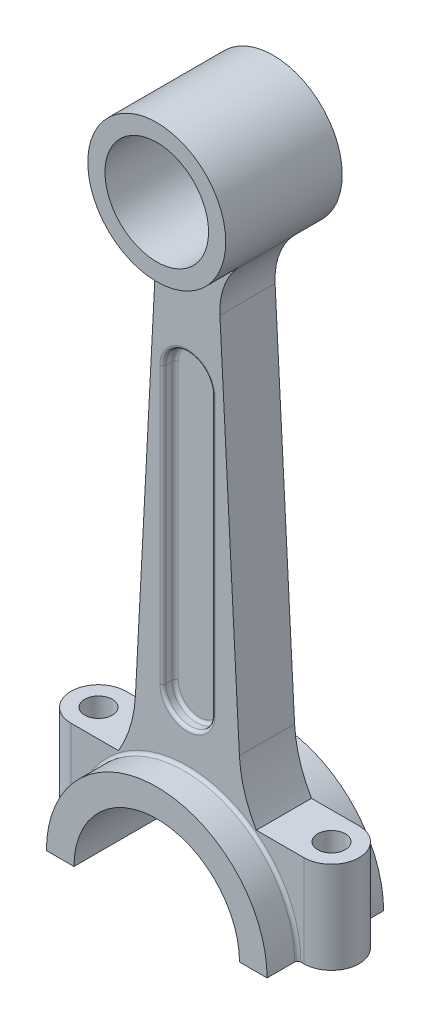
from build123d import *

# Parameters (mm, degrees)
BOSS_EXTRUDE1_DEPTH   = 19
SKETCH1_R             = 22.5
SKETCH1_R_2           = 16.9
BOSS_EXTRUDE1_2_DEPTH = 19
BOSS_EXTRUDE2_DEPTH   = 9
CUT_EXTRUDE1_DEPTH    = 4
FILLET2_R             = 1
FILLET3_R             = 22.5
FILLET4_R             = 40
BOSS_EXTRUDE3_REACH   = 199.931
SKETCH3_R             = 4.5
CUT_EXTRUDE2_DEPTH    = 209.505251829
FILLET5_R             = 1


with BuildPart() as part:
    # Sketch1 → Boss-Extrude1 (new, symmetric)
    with BuildSketch(Plane.XY):
        with BuildLine():
            ThreePointArc((-27, -201.2), (0, -174.2), (27, -201.2))
            Line((27, -201.2), (36, -201.2))
            ThreePointArc((36, -201.2), (0, -165.2), (-36, -201.2))
            Line((-36, -201.2), (-27, -201.2))
        make_face()
    extrude(amount=BOSS_EXTRUDE1_DEPTH, both=True)



with BuildPart() as body_2:
    # Sketch1 → Boss-Extrude1 2 (new, symmetric)
    with BuildSketch(Plane.XY):
        Circle(SKETCH1_R)
        Circle(SKETCH1_R_2, mode=Mode.SUBTRACT)
    extrude(amount=BOSS_EXTRUDE1_2_DEPTH, both=True)


with BuildPart() as part_1:
    add(part.part)

    add(body_2.part)  # Boss-Extrude2 merges body 2
    # Sketch1<3> → Boss-Extrude2 (add, symmetric)
    with BuildSketch(Plane.XY):
        with BuildLine():
            ThreePointArc((-17.849697213, -169.936789841), (-9.233754228, -166.404342471), (0, -165.2))
            Line((0, -165.2), (0, -22.5))
            ThreePointArc((0, -22.5), (-5.135562367, -21.906072199), (-10, -20.155644371))
            Line((-10, -20.155644371), (-17.849697213, -169.936789841))
        make_face()
        with BuildLine():
            Line((0, -22.5), (0, -165.2))
            ThreePointArc((0, -165.2), (9.233754228, -166.404342471), (17.849697213, -169.936789841))
            Line((17.849697213, -169.936789841), (10, -20.155644371))
            ThreePointArc((10, -20.155644371), (5.135562367, -21.906072199), (0, -22.5))
        make_face()
    extrude(amount=BOSS_EXTRUDE2_DEPTH, both=True)

    # Sketch2 → Cut-Extrude1 (cut)
    with BuildSketch(Plane.XY.offset(9)):
        with BuildLine():
            Line((8, -55.560443659), (8, -145.560443659))
            ThreePointArc((8, -145.560443659), (0, -153.560443659), (-8, -145.560443659))
            Line((-8, -145.560443659), (-8, -55.560443659))
            ThreePointArc((-8, -55.560443659), (0, -47.560443659), (8, -55.560443659))
        make_face()
    cut_extrude1 = extrude(amount=-CUT_EXTRUDE1_DEPTH, mode=Mode.SUBTRACT)

    # Mirror1: Cut-Extrude1 across plane
    add(cut_extrude1.mirror(Plane.XY), mode=Mode.SUBTRACT)

    # Fillet2
    fillet2_edges = [part_1.edges().sort_by_distance(p)[0] for p in [
        (0, -47.560443659, 5),
        (8, -100.560443659, 5),
        (0, -153.560443659, 5),
        (-8, -100.560443659, 5),
        (0, -47.560443659, 9),
        (-8, -100.560443659, 9),
        (0, -153.560443659, 9),
        (8, -100.560443659, 9),
        (0, -47.560443659, -9),
        (-8, -100.560443659, -9),
        (0, -153.560443659, -9),
        (8, -100.560443659, -9),
        (0, -47.560443659, -5),
        (-8, -100.560443659, -5),
        (0, -153.560443659, -5),
        (8, -100.560443659, -5),
    ]]
    fillet(fillet2_edges, radius=FILLET2_R)

    # Fillet3
    fillet3_edges = [part_1.edges().sort_by_distance(p)[0] for p in [
        (10, -20.155644371, 0),
        (-10, -20.155644371, 0),
    ]]
    fillet(fillet3_edges, radius=FILLET3_R)

    # Fillet4
    fillet4_edges = [part_1.edges().sort_by_distance(p)[0] for p in [
        (-17.849697213, -169.936789841, 0),
        (17.849697213, -169.936789841, 0),
    ]]
    fillet(fillet4_edges, radius=FILLET4_R)

    # Boss-Extrude3: up to this face of the body (flat: up to its plane)
    boss_extrude3_end = Plane(part_1.part.faces().sort_by_distance((-31.5, -201.2, 0))[0])
    # Sketch3 → Boss-Extrude3 (add, up to the picked face)
    with BuildSketch(Plane(origin=(0, -171.2, 0), x_dir=(-1, 0, 0), z_dir=(0, -1, 0)), mode=Mode.PRIVATE) as boss_extrude3_sk1:
        with BuildLine():
            Line((38, -9), (-38, -9))
            ThreePointArc((-38, -9), (-47, 0), (-38, 9))
            Line((-38, 9), (38, 9))
            ThreePointArc((38, 9), (47, 0), (38, -9))
        make_face()
        with Locations(Location((-38, 0, 0), (0, 0, 296.387799961))):
            Circle(SKETCH3_R, mode=Mode.SUBTRACT)
        with Locations(Location((38, 0, 0), (0, 0, 243.612200039))):
            Circle(SKETCH3_R, mode=Mode.SUBTRACT)
    boss_extrude3_tool1 = split(extrude(boss_extrude3_sk1.sketch, amount=BOSS_EXTRUDE3_REACH, mode=Mode.PRIVATE), bisect_by=boss_extrude3_end, keep=Keep.BOTH, mode=Mode.PRIVATE)
    add(boss_extrude3_tool1.solids().sort_by(Axis((0, -171.2, 0), (0, -1, 0)))[0])

    # Sketch4 → Cut-Extrude2 (cut, through all)
    with BuildSketch(Plane(origin=(0, 0, -9), x_dir=(-1, 0, 0), z_dir=(0, 0, -1))):
        with BuildLine():
            Line((-27, -201.2), (27, -201.2))
            ThreePointArc((27, -201.2), (0, -174.2), (-27, -201.2))
        make_face()
    extrude(amount=-CUT_EXTRUDE2_DEPTH, mode=Mode.SUBTRACT)

    # Fillet5
    fillet5_edges = [part_1.edges().sort_by_distance(p)[0] for p in [
        (0, -165.2, 9),
        (0, -165.2, -9),
    ]]
    fillet(fillet5_edges, radius=FILLET5_R)


solid = part_1.part
